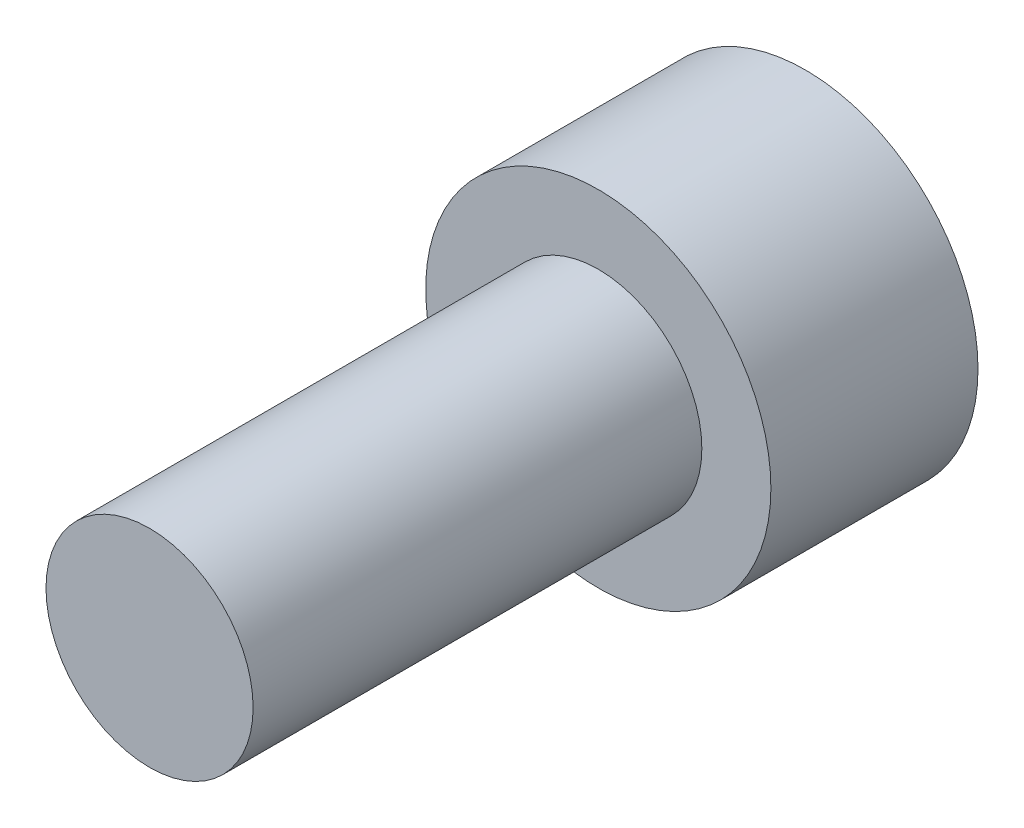
from build123d import *

# Parameters (mm, degrees)
SKETCH_1_R      = 5
EXTRUDE_1_DEPTH = 6
SKETCH_2_R      = 3
EXTRUDE_2_DEPTH = 13


with BuildPart() as part:
    # 草图1 → 凸台-拉伸1 (new body)
    with BuildSketch(Plane.XY):
        Circle(SKETCH_1_R)
    extrude(amount=EXTRUDE_1_DEPTH)

    # 草图2 → 凸台-拉伸2 (add)
    with BuildSketch(Plane.XY.offset(6)):
        with Locations(Location((0, 0, 0), (0, 0, 180))):
            Circle(SKETCH_2_R)
    extrude(amount=EXTRUDE_2_DEPTH)


solid = part.part
